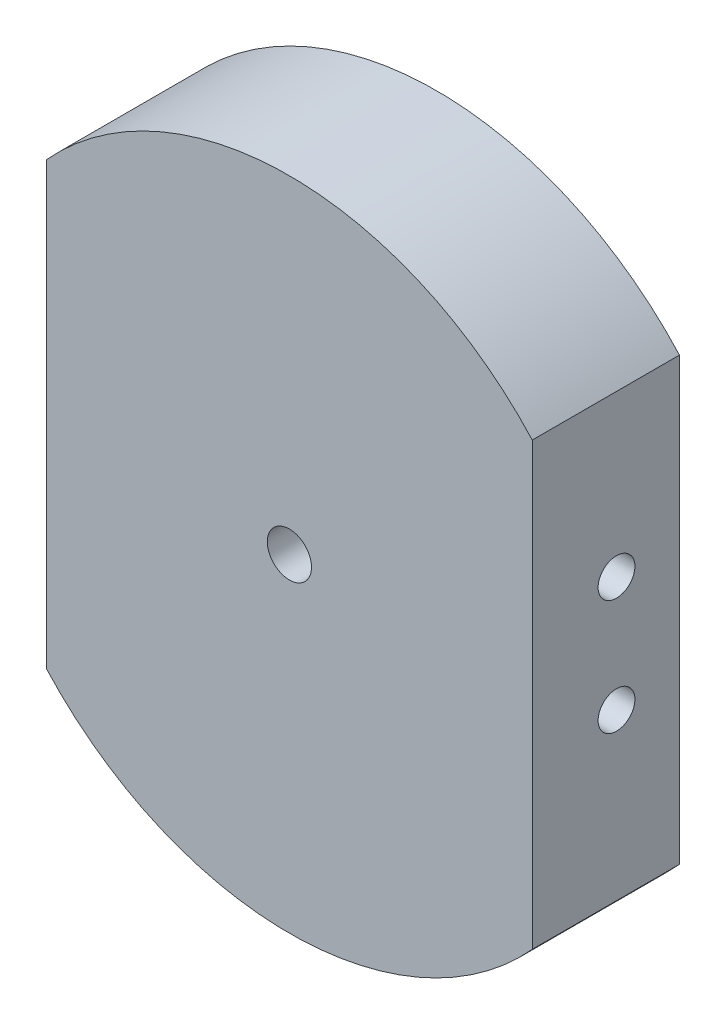
from build123d import *

# Parameters (mm, degrees)
SKETCH1_R           = 55
SKETCH1_R_2         = 3
BOSS_EXTRUDE1_DEPTH = 20
SKETCH2_R           = 52
CUT_EXTRUDE1_DEPTH  = 10
SKETCH3_R           = 73.645142789
CUT_EXTRUDE2_DEPTH  = 40
CUT_EXTRUDE4_START  = -58
CUT_EXTRUDE4_DEPTH  = 58
SKETCH5_R           = 2.5
CUT_EXTRUDE3_DEPTH  = 110


with BuildPart() as part:
    # Sketch1 → Boss-Extrude1 (new body)
    with BuildSketch(Plane.XY):
        Circle(SKETCH1_R)
        Circle(SKETCH1_R_2, mode=Mode.SUBTRACT)
    extrude(amount=BOSS_EXTRUDE1_DEPTH)

    # Sketch2 → Cut-Extrude1 (cut)
    with BuildSketch(Plane.XY.offset(20)):
        Circle(SKETCH2_R)
        with BuildLine():
            Line((-41.361950208, 16.620711788), (-41.361950208, -16.620711788))
            ThreePointArc((-41.361950208, -16.620711788), (0, -44.576439802), (41.361950208, -16.620711788))
            Line((41.361950208, -16.620711788), (41.361950208, 16.620711788))
            ThreePointArc((41.361950208, 16.620711788), (0, 44.576439802), (-41.361950208, 16.620711788))
        make_face(mode=Mode.SUBTRACT)
    extrude(amount=-CUT_EXTRUDE1_DEPTH, mode=Mode.SUBTRACT)

    # Sketch3 → Cut-Extrude2 (cut)
    with BuildSketch(Plane.XY.offset(20)):
        Circle(SKETCH3_R)
        with BuildLine():
            Line((-41.361950208, 16.620711788), (-41.361950208, -16.620711788))
            ThreePointArc((-41.361950208, -16.620711788), (0, -44.576439802), (41.361950208, -16.620711788))
            Line((41.361950208, -16.620711788), (41.361950208, 16.620711788))
            ThreePointArc((41.361950208, 16.620711788), (0, 44.576439802), (-41.361950208, 16.620711788))
        make_face(mode=Mode.SUBTRACT)
    extrude(amount=-CUT_EXTRUDE2_DEPTH, mode=Mode.SUBTRACT)

    # Sketch6 → Cut-Extrude4 (cut)
    with BuildSketch(Plane(origin=(0, 0, 0), x_dir=(-1, 0, 0), z_dir=(0, 0, -1)).offset(CUT_EXTRUDE4_START)):
        with BuildLine():
            ThreePointArc((-41.361950208, 16.620711788), (-37.775123844, 23.66641088), (-33, 29.967632295))
            Line((-33, 29.967632295), (-58.675122088, 18.005162572))
            Line((-58.675122088, 18.005162572), (-58.675122088, -19.387832384))
            Line((-58.675122088, -19.387832384), (-33, -29.967632295))
            ThreePointArc((-33, -29.967632295), (-37.775123844, -23.66641088), (-41.361950208, -16.620711788))
            Line((-41.361950208, -16.620711788), (-41.361950208, 16.620711788))
        make_face()
        with BuildLine():
            Line((-33, -29.967632295), (-33, 29.967632295))
            ThreePointArc((-33, 29.967632295), (-37.775123844, 23.66641088), (-41.361950208, 16.620711788))
            Line((-41.361950208, 16.620711788), (-41.361950208, -16.620711788))
            ThreePointArc((-41.361950208, -16.620711788), (-37.775123844, -23.66641088), (-33, -29.967632295))
        make_face()
        with BuildLine():
            Line((59.4434713, 26.815208095), (33, 29.967632295))
            ThreePointArc((33, 29.967632295), (37.775123844, 23.66641088), (41.361950208, 16.620711788))
            Line((41.361950208, 16.620711788), (41.361950208, -16.620711788))
            ThreePointArc((41.361950208, -16.620711788), (37.775123844, -23.66641088), (33, -29.967632295))
            Line((33, -29.967632295), (59.4434713, -14.291474717))
            Line((59.4434713, -14.291474717), (59.4434713, 26.815208095))
        make_face()
        with BuildLine():
            ThreePointArc((41.361950208, 16.620711788), (37.775123844, 23.66641088), (33, 29.967632295))
            Line((33, 29.967632295), (33, -29.967632295))
            ThreePointArc((33, -29.967632295), (37.775123844, -23.66641088), (41.361950208, -16.620711788))
            Line((41.361950208, -16.620711788), (41.361950208, 16.620711788))
        make_face()
    extrude(amount=CUT_EXTRUDE4_DEPTH, mode=Mode.SUBTRACT)

    # Sketch5 → Cut-Extrude3 (cut)
    with BuildSketch(Plane(origin=(33, 0, 0), x_dir=(0, 0, -1), z_dir=(1, 0, 0))):
        with Locations((-8.553262896, -7.517843705)):
            Circle(SKETCH5_R)
        with Locations((-8.553262896, 8.14)):
            Circle(SKETCH5_R)
    extrude(amount=-CUT_EXTRUDE3_DEPTH, mode=Mode.SUBTRACT)


solid = part.part
